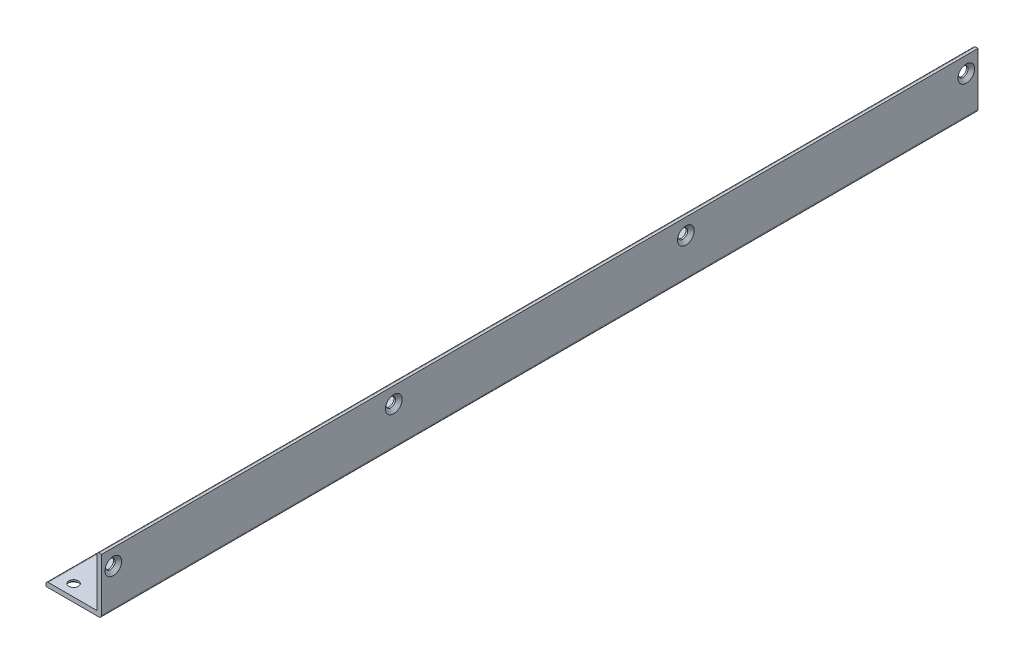
from build123d import *

# Parameters (mm, degrees)
BOSS_EXTRUDE1_DEPTH                               = 150
CSK_FOR_4_FLAT_HEAD_MACHINE_SCREW_100_D           = 3.2639
CSK_FOR_4_FLAT_HEAD_MACHINE_SCREW_100_CSINK_D     = 5.715
CSK_FOR_4_FLAT_HEAD_MACHINE_SCREW_100_CSINK_ANGLE = 100
CSK_FOR_4_FLAT_HEAD_MACHINE_SCREW_2_D             = 3.2639
CSK_FOR_4_FLAT_HEAD_MACHINE_SCREW_2_CSINK_D       = 5.715
CSK_FOR_4_FLAT_HEAD_MACHINE_SCREW_2_CSINK_ANGLE   = 100
FILLET1_R                                         = 1
F_2_CLEARANCE_HOLE1_AT_2_COUNT                    = 2
F_2_CLEARANCE_HOLE1_AT_2_PITCH                    = 4.8
CSK_FOR_4_FLAT_HEAD_MACHINE_SCREW_3_D             = 3.2639
CSK_FOR_4_FLAT_HEAD_MACHINE_SCREW_3_CSINK_D       = 5.715
CSK_FOR_4_FLAT_HEAD_MACHINE_SCREW_3_CSINK_ANGLE   = 100
CSK_FOR_4_FLAT_HEAD_MACHINE_SCREW_4_D             = 3.2639
CSK_FOR_4_FLAT_HEAD_MACHINE_SCREW_4_CSINK_D       = 5.715
CSK_FOR_4_FLAT_HEAD_MACHINE_SCREW_4_CSINK_ANGLE   = 100
CSK_FOR_4_FLAT_HEAD_MACHINE_SCREW_5_D             = 3.2639
CSK_FOR_4_FLAT_HEAD_MACHINE_SCREW_5_CSINK_D       = 5.715
CSK_FOR_4_FLAT_HEAD_MACHINE_SCREW_5_CSINK_ANGLE   = 100
CSK_FOR_4_FLAT_HEAD_MACHINE_SCREW_6_D             = 3.2639
CSK_FOR_4_FLAT_HEAD_MACHINE_SCREW_6_CSINK_D       = 5.715
CSK_FOR_4_FLAT_HEAD_MACHINE_SCREW_6_CSINK_ANGLE   = 100
CUT_EXTRUDE1_DEPTH                                = 25


with BuildPart() as part:
    # Sketch2 → Boss-Extrude1 (new, symmetric)
    with BuildSketch(Plane.XY):
        with BuildLine():
            Line((-9.525, 0), (9.525, 0))
            Line((9.525, 0), (9.525, 19.05))
            Line((9.525, 19.05), (8.73125, 19.05))
            ThreePointArc((8.73125, 19.05), (8.169983992, 18.817516008), (7.9375, 18.25625))
            Line((7.9375, 18.25625), (7.9375, 2.38125))
            ThreePointArc((7.9375, 2.38125), (7.705016008, 1.819983992), (7.14375, 1.5875))
            Line((7.14375, 1.5875), (-8.73125, 1.5875))
            ThreePointArc((-8.73125, 1.5875), (-9.292516008, 1.355016008), (-9.525, 0.79375))
            Line((-9.525, 0.79375), (-9.525, 0))
        make_face()
    extrude(amount=BOSS_EXTRUDE1_DEPTH, both=True)

    # CSK for _4 Flat Head Machine Screw _100 (through all)
    with Locations(Plane(origin=(0, 0, 0), x_dir=(-1, 0, 0), z_dir=(0, -1, 0))):
        with Locations((4.0625, -146), (4.0625, 146)):
            CounterSinkHole(CSK_FOR_4_FLAT_HEAD_MACHINE_SCREW_100_D / 2, CSK_FOR_4_FLAT_HEAD_MACHINE_SCREW_100_CSINK_D / 2, counter_sink_angle=CSK_FOR_4_FLAT_HEAD_MACHINE_SCREW_100_CSINK_ANGLE)

    # CSK for _4 Flat Head Machine Screw _ 2 (through all)
    with Locations(Plane(origin=(9.525, 0, 0), x_dir=(0, 0, -1), z_dir=(1, 0, 0))):
        with Locations((-146, 13.5875), (146, 13.5875)):
            CounterSinkHole(CSK_FOR_4_FLAT_HEAD_MACHINE_SCREW_2_D / 2, CSK_FOR_4_FLAT_HEAD_MACHINE_SCREW_2_CSINK_D / 2, counter_sink_angle=CSK_FOR_4_FLAT_HEAD_MACHINE_SCREW_2_CSINK_ANGLE)

    # Fillet1
    fillet1_edges = [part.edges().sort_by_distance(p)[0] for p in [
        (9.525, 0, 0),
    ]]
    fillet(fillet1_edges, radius=FILLET1_R)

    # Sketch30 → #2 Clearance Hole1 (revolve, cut)
    with BuildSketch(Plane(origin=(3.49375, 1.5875, 129.88), x_dir=(0, 0, 1), z_dir=(1, 0, 0))):
        Polygon((0, 0), (0, 1.5875), (2.0574, 1.5875), (1.2192, 0.623261201), (1.2192, 0), align=None)
    f_2_clearance_hole1 = revolve(axis=Axis((3.49375, 7.9375, 129.88), (0, -1, 0)), mode=Mode.SUBTRACT)

    # #2 Clearance Hole1 at 2: #2 Clearance Hole1 ×2
    with Locations(*[(-i * F_2_CLEARANCE_HOLE1_AT_2_PITCH, 0, 0) for i in range(1, F_2_CLEARANCE_HOLE1_AT_2_COUNT)]):
        add(f_2_clearance_hole1, mode=Mode.SUBTRACT)

    # CSK for _4 Flat Head Machine Screw _ 3 (through all)
    with Locations(Plane(origin=(0, 0, 0), x_dir=(-1, 0, 0), z_dir=(0, -1, 0))):
        with Locations((4.0625, 50)):
            CounterSinkHole(CSK_FOR_4_FLAT_HEAD_MACHINE_SCREW_3_D / 2, CSK_FOR_4_FLAT_HEAD_MACHINE_SCREW_3_CSINK_D / 2, counter_sink_angle=CSK_FOR_4_FLAT_HEAD_MACHINE_SCREW_3_CSINK_ANGLE)

    # CSK for _4 Flat Head Machine Screw _ 4 (through all)
    with Locations(Plane(origin=(9.525, 0, 0), x_dir=(0, 0, -1), z_dir=(1, 0, 0))):
        with Locations((50, 13.5875)):
            CounterSinkHole(CSK_FOR_4_FLAT_HEAD_MACHINE_SCREW_4_D / 2, CSK_FOR_4_FLAT_HEAD_MACHINE_SCREW_4_CSINK_D / 2, counter_sink_angle=CSK_FOR_4_FLAT_HEAD_MACHINE_SCREW_4_CSINK_ANGLE)

    # CSK for _4 Flat Head Machine Screw _ 5 (through all)
    with Locations(Plane(origin=(9.525, 0, 0), x_dir=(0, 0, -1), z_dir=(1, 0, 0))):
        with Locations((-50, 13.5875)):
            CounterSinkHole(CSK_FOR_4_FLAT_HEAD_MACHINE_SCREW_5_D / 2, CSK_FOR_4_FLAT_HEAD_MACHINE_SCREW_5_CSINK_D / 2, counter_sink_angle=CSK_FOR_4_FLAT_HEAD_MACHINE_SCREW_5_CSINK_ANGLE)

    # CSK for _4 Flat Head Machine Screw _ 6 (through all)
    with Locations(Plane(origin=(0, 0, 0), x_dir=(-1, 0, 0), z_dir=(0, -1, 0))):
        with Locations((4.0625, -50)):
            CounterSinkHole(CSK_FOR_4_FLAT_HEAD_MACHINE_SCREW_6_D / 2, CSK_FOR_4_FLAT_HEAD_MACHINE_SCREW_6_CSINK_D / 2, counter_sink_angle=CSK_FOR_4_FLAT_HEAD_MACHINE_SCREW_6_CSINK_ANGLE)

    # Sketch44 → Cut-Extrude1 (cut)
    with BuildSketch(Plane.XY.offset(150)):
        Polygon((7.9375, 6.5875), (7.9375, 1.5875), (2.9375, 1.5875), align=None)
    cut_extrude1 = extrude(amount=-CUT_EXTRUDE1_DEPTH, mode=Mode.SUBTRACT)

    # Mirror1: Cut-Extrude1 across plane
    add(cut_extrude1.mirror(Plane.XY), mode=Mode.SUBTRACT)


solid = part.part
